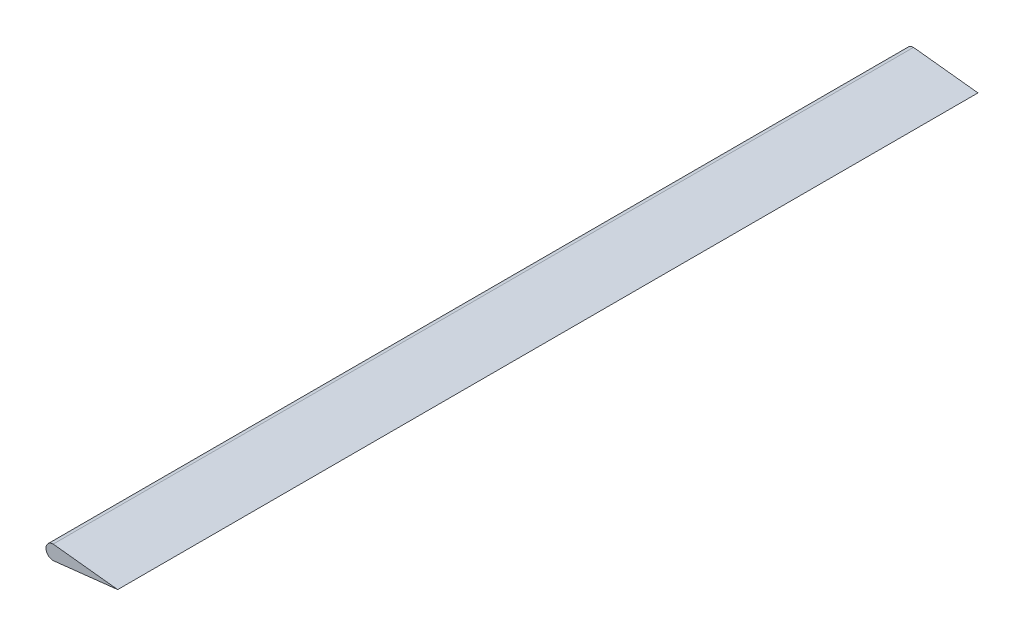
from build123d import *

# Parameters (mm, degrees)
BOSS_EXTRUDE1_DEPTH = 12000


with BuildPart() as part:
    # Sketch1 → Boss-Extrude1 (new body)
    with BuildSketch(Plane.XY):
        with BuildLine():
            Line((100, 100), (1000, 0))
            Line((1000, 0), (100, -100))
            ThreePointArc((100, -100), (0, 0), (100, 100))
        make_face()
    extrude(amount=BOSS_EXTRUDE1_DEPTH)


solid = part.part
